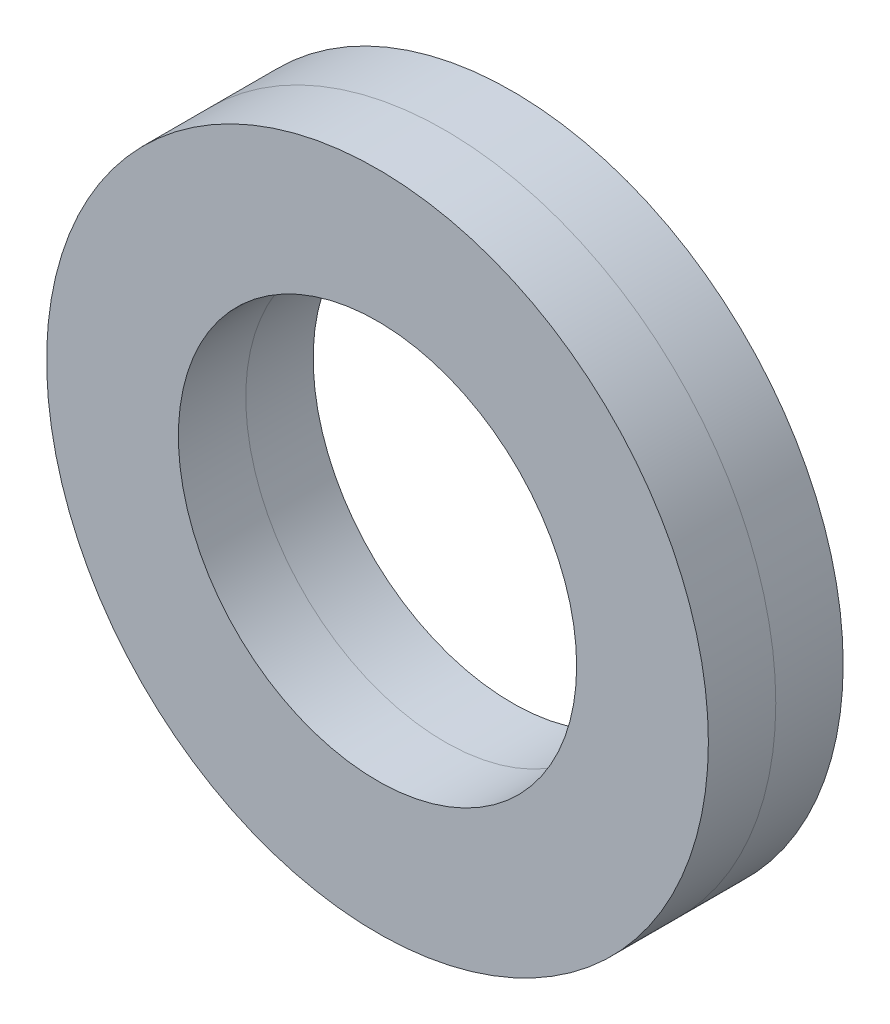
from build123d import *

# Parameters (mm, degrees)
SKETCH_8_W   = 1.1
SKETCH_8_H   = 2.15
SKETCH_8_8_W = 1.1
SKETCH_8_8_H = 2.15


with BuildPart() as part:
    # 草图8 → 旋转3 (revolve)
    with BuildSketch(Plane(origin=(0, 0, 0), x_dir=(0, 0, -1), z_dir=(1, 0, 0))):
        with Locations((-0.55, 4.325)):
            Rectangle(SKETCH_8_W, SKETCH_8_H)
    revolve(axis=Axis((0, 0, 0), (0, 0, -1)))


with BuildPart() as body_2:
    # 草图8<8> → 旋转4 (revolve)
    with BuildSketch(Plane(origin=(0, 0, 0), x_dir=(0, 0, -1), z_dir=(1, 0, 0))):
        with Locations((0.55, 4.325)):
            Rectangle(SKETCH_8_8_W, SKETCH_8_8_H)
    revolve(axis=Axis((0, 0, 0), (0, 0, -1)))


solid = Compound([part.part, body_2.part])
